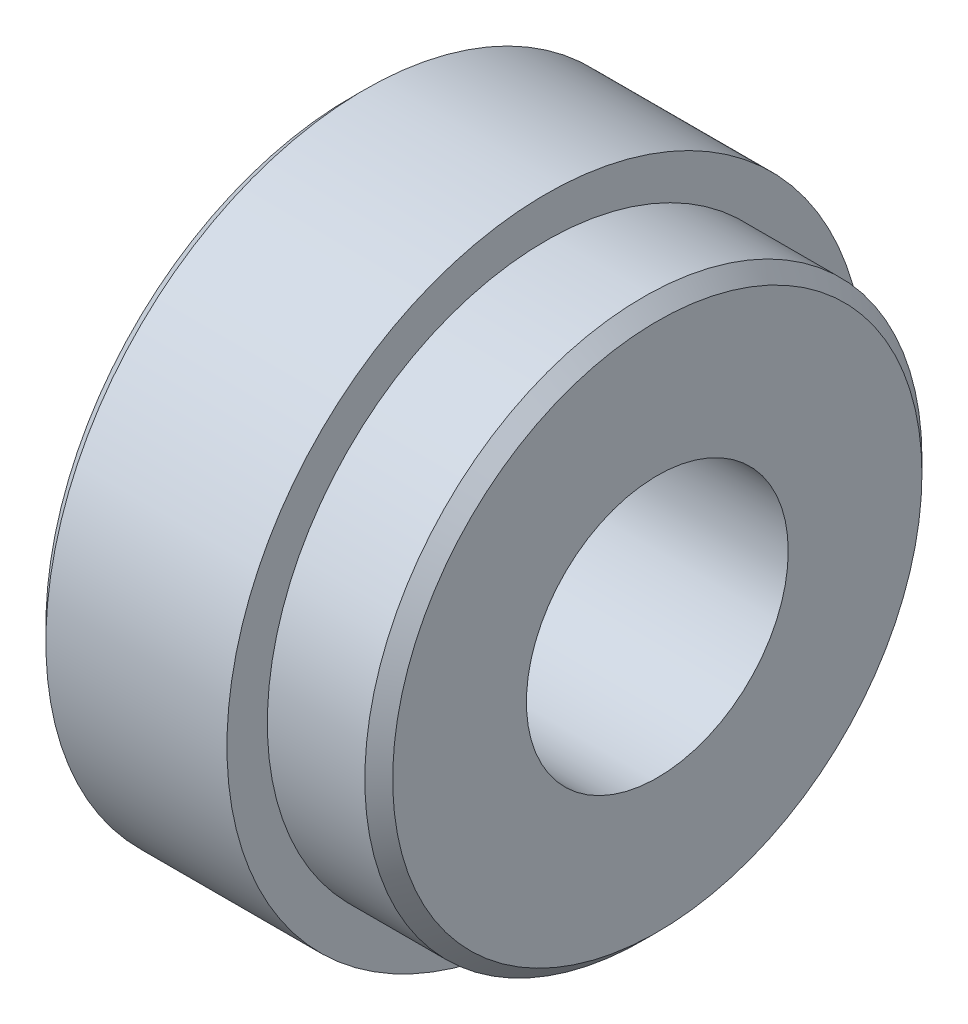
from build123d import *

# Parameters (mm, degrees)
SKETCH1_R           = 11.45
BOSS_EXTRUDE1_DEPTH = 7
SKETCH2_R           = 10
BOSS_EXTRUDE2_DEPTH = 4
SKETCH3_R           = 4.7
CUT_EXTRUDE1_DEPTH  = 20.575622595
CHAMFER1_SIZE       = 0.5


with BuildPart() as part:
    # Sketch1 → Boss-Extrude1 (new body)
    with BuildSketch(Plane(origin=(0, 0, 0), x_dir=(0, 0, -1), z_dir=(1, 0, 0))):
        Circle(SKETCH1_R)
    extrude(amount=BOSS_EXTRUDE1_DEPTH)

    # Sketch2 → Boss-Extrude2 (add)
    with BuildSketch(Plane(origin=(7, 0, 0), x_dir=(0, 0, -1), z_dir=(1, 0, 0))):
        Circle(SKETCH2_R)
    extrude(amount=BOSS_EXTRUDE2_DEPTH)

    # Sketch3 → Cut-Extrude1 (cut, through all)
    with BuildSketch(Plane(origin=(11, 0, 0), x_dir=(0, 0, -1), z_dir=(1, 0, 0))):
        Circle(SKETCH3_R)
    extrude(amount=-CUT_EXTRUDE1_DEPTH, mode=Mode.SUBTRACT)

    # Chamfer1
    chamfer1_edges = [part.edges().sort_by_distance(p)[0] for p in [
        (0, 0, 4.7),
        (0, 0, 11.45),
        (11, 0, 10),
    ]]
    chamfer(chamfer1_edges, length=CHAMFER1_SIZE)


solid = part.part
